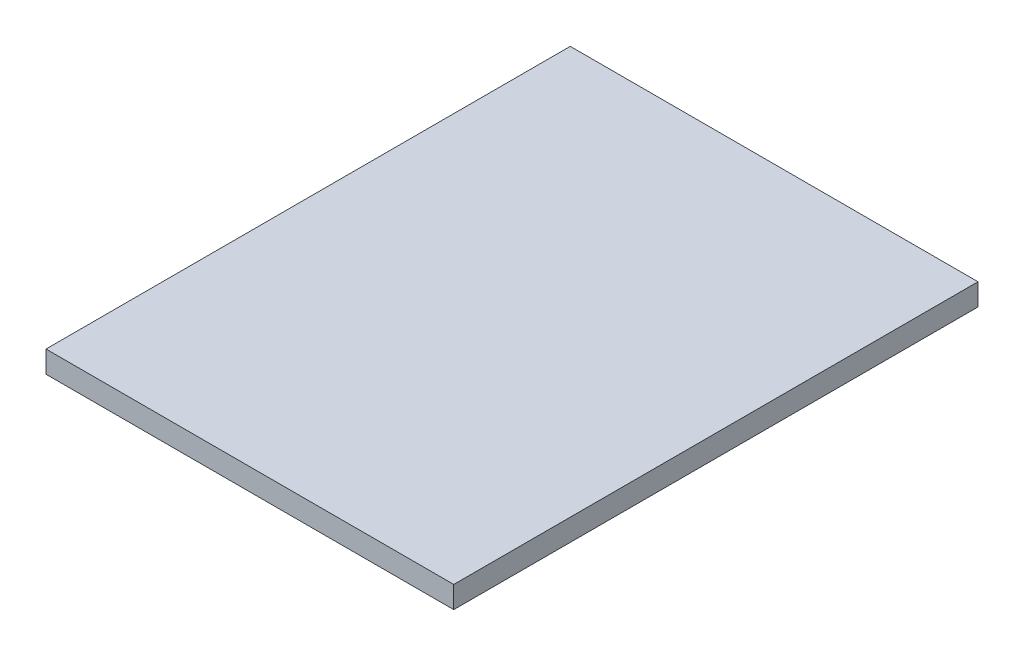
from build123d import *

# Parameters (mm, degrees)
SKETCH1_W           = 177.8
SKETCH1_H           = 228.6
BOSS_EXTRUDE1_DEPTH = 9.525


with BuildPart() as part:
    # Sketch1 → Boss-Extrude1 (new body)
    with BuildSketch(Plane(origin=(0, 0, 0), x_dir=(1, 0, 0), z_dir=(0, 1, 0))):
        Rectangle(SKETCH1_W, SKETCH1_H)
    extrude(amount=BOSS_EXTRUDE1_DEPTH)


solid = part.part
